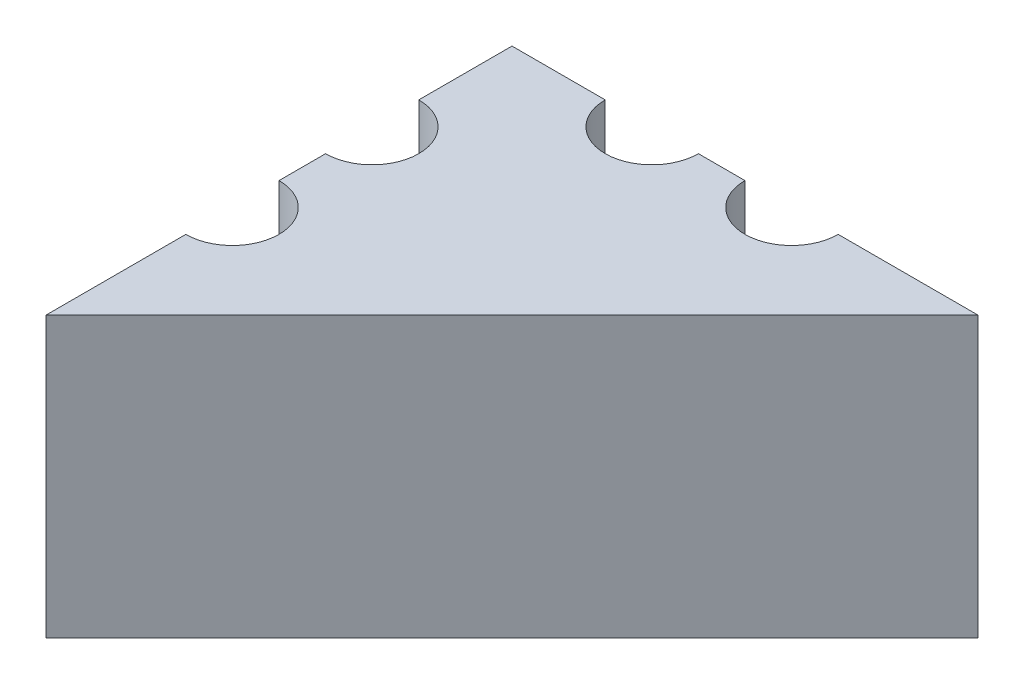
from build123d import *

# Parameters (mm, degrees)
BOSS_EXTRUDE1_DEPTH = 6
SKETCH2_R           = 1
CUT_EXTRUDE1_DEPTH  = 16.362291496


with BuildPart() as part:
    # Sketch1 → Boss-Extrude1 (new body)
    with BuildSketch(Plane(origin=(0, 0, 0), x_dir=(1, 0, 0), z_dir=(0, 1, 0))):
        Polygon((0, 0), (10, 0), (0, -10), align=None)
    extrude(amount=BOSS_EXTRUDE1_DEPTH)

    # Sketch2 → Cut-Extrude1 (cut, through all)
    with BuildSketch(Plane(origin=(0, 6, 0), x_dir=(1, 0, 0), z_dir=(0, 1, 0))):
        with Locations((0, -6)):
            Circle(SKETCH2_R)
        with Locations((0, -3)):
            Circle(SKETCH2_R)
        with Locations((3, 0)):
            Circle(SKETCH2_R)
        with Locations((6, 0)):
            Circle(SKETCH2_R)
    extrude(amount=-CUT_EXTRUDE1_DEPTH, mode=Mode.SUBTRACT)


solid = part.part
